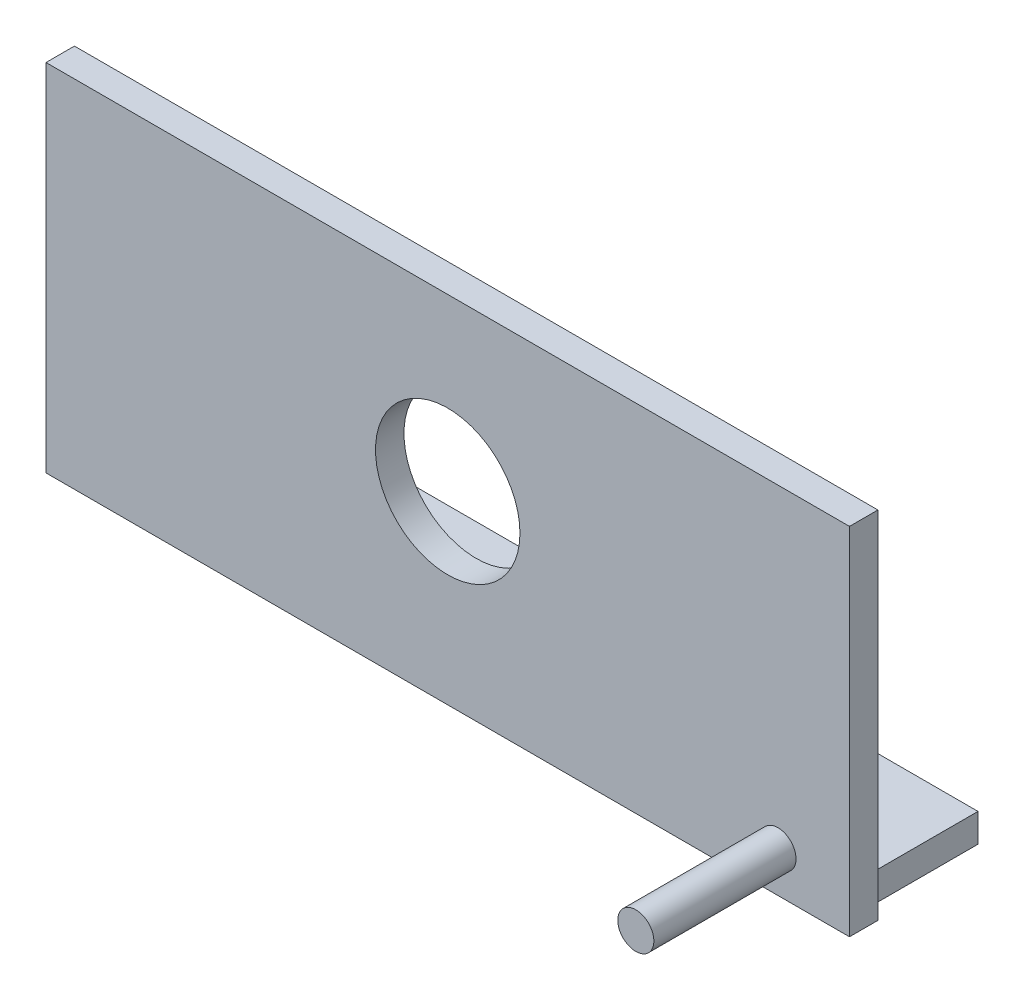
from build123d import *

# Parameters (mm, degrees)
CROQUIS1_R              = 12.7
SALIENTE_EXTRUIR1_DEPTH = 5
CROQUIS3_W              = 135.679587796
CROQUIS3_H              = 5
SALIENTE_EXTRUIR3_DEPTH = 25.4
CROQUIS4_R              = 3.175
SALIENTE_EXTRUIR4_DEPTH = 25
SALIENTE_EXTRUIR5_DEPTH = 5


with BuildPart() as part:
    # Croquis1 → Saliente-Extruir1 (new body)
    with BuildSketch(Plane.XY):
        Polygon((67.839793898, 2.498030194), (34.641016151, 60), (-34.641016151, 60), (-67.839793898, 2.498030194), align=None)
        with Locations((0, 30)):
            Circle(CROQUIS1_R, mode=Mode.SUBTRACT)
    extrude(amount=SALIENTE_EXTRUIR1_DEPTH)

    # Croquis3 → Saliente-Extruir3 (add)
    with BuildSketch(Plane.XY.offset(5)):
        with Locations((0, -0.001969806)):
            Rectangle(CROQUIS3_W, CROQUIS3_H)
    extrude(amount=-SALIENTE_EXTRUIR3_DEPTH)

    # Croquis4 → Saliente-Extruir4 (add)
    with BuildSketch(Plane.XY.offset(5)):
        with Locations((58.069793898, 4.658030194)):
            Circle(CROQUIS4_R)
    extrude(amount=SALIENTE_EXTRUIR4_DEPTH)

    # Croquis5 → Saliente-Extruir5 (add)
    with BuildSketch(Plane.XY.offset(5)):
        Polygon((70.641016151, 60), (70.641016151, -2.501969806), (67.839793898, -2.501969806), (67.839793898, 2.498030194), (34.641016151, 60), align=None)
        Polygon((-67.839793898, -2.501969806), (-67.839793898, 2.498030194), (-34.641016151, 60), (-70.641016151, 60), (-70.641016151, -2.501969806), align=None)
    extrude(amount=-SALIENTE_EXTRUIR5_DEPTH)


solid = part.part
